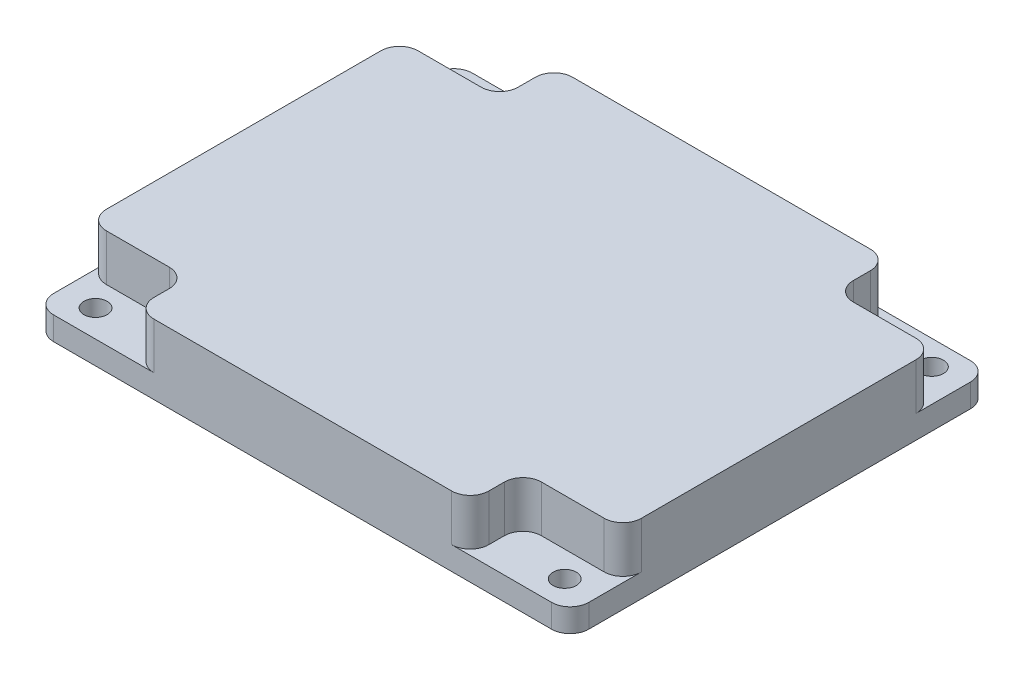
from build123d import *

# Parameters (mm, degrees)
SKETCH_1_W          = 115
SKETCH_1_H          = 90
EXTRUDE_1_DEPTH     = 15
SKETCH_2_W          = 110
SKETCH_2_H          = 85
CUT_EXTRUDE_1_DEPTH = 13
SKETCH_4_R          = 2.5
CUT_EXTRUDE_2_DEPTH = 13
CUT_EXTRUDE_3_DEPTH = 10
EXTRUDE_2_DEPTH     = 13
SKETCH_8_W          = 23.526984817
SKETCH_8_H          = 13.315340632
SKETCH_8_W_2        = 23.473015183
SKETCH_8_H_2        = 13.660063904
SKETCH_8_H_3        = 13.684659368
EXTRUDE_4_DEPTH     = 5
FILLET_1_R          = 4
FILLET_2_R          = 4
SKETCH_9_R          = 2.5
CUT_EXTRUDE_4_DEPTH = 25


with BuildPart() as part:
    # Эскиз1 → Бобышка-Вытянуть1 (new body)
    with BuildSketch(Plane(origin=(0, 0, 0), x_dir=(1, 0, 0), z_dir=(0, 1, 0))):
        with Locations((-0.217418325, 0.217418325)):
            Rectangle(SKETCH_1_W, SKETCH_1_H)
    extrude(amount=EXTRUDE_1_DEPTH)

    # Эскиз2 → Вырез-Вытянуть1 (cut)
    with BuildSketch(Plane.XZ):
        Rectangle(SKETCH_2_W, SKETCH_2_H)
    extrude(amount=-CUT_EXTRUDE_1_DEPTH, mode=Mode.SUBTRACT)

    # Эскиз4 → Вырез-Вытянуть2 (cut)
    with BuildSketch(Plane(origin=(0, 15, 0), x_dir=(1, 0, 0), z_dir=(0, 1, 0))):
        with Locations(Location((-50.146124261, 38.945020388, 0), (0, 0, 270))):
            Circle(SKETCH_4_R)
        with Locations(Location((50.678785721, -39.961430902, 0), (0, 0, 270))):
            Circle(SKETCH_4_R)
        with Locations(Location((-50.146124261, -39.961430902, 0), (0, 0, 270))):
            Circle(SKETCH_4_R)
        with Locations(Location((50.678785721, 38.945020388, 0), (0, 0, 270))):
            Circle(SKETCH_4_R)
    extrude(amount=-CUT_EXTRUDE_2_DEPTH, mode=Mode.SUBTRACT)

    # Эскиз5 → Вырез-Вытянуть3 (cut)
    with BuildSketch(Plane(origin=(0, 15, 0), x_dir=(1, 0, 0), z_dir=(0, 1, 0))):
        Polygon((-56.190433508, 33.532758957), (-36.190433508, 33.532758957), (-36.190433508, 43.532758957), (-36.190433508, 45.217418325), (-57.717418325, 45.217418325), (-57.717418325, 33.532758957), align=None)
        Polygon((-56.190433508, -33.467241043), (-36.190433508, -33.467241043), (-36.190433508, -43.467241043), (-36.190433508, -44.782581675), (-57.717418325, -44.782581675), (-57.717418325, -33.467241043), align=None)
        Polygon((55.809566492, -33.467241043), (35.809566492, -33.467241043), (35.809566492, -43.467241043), (35.809566492, -44.782581675), (57.282581675, -44.782581675), (57.282581675, -33.467241043), align=None)
        Polygon((55.809566492, 33.532758957), (35.809566492, 33.532758957), (35.809566492, 43.532758957), (35.809566492, 45.217418325), (57.282581675, 45.217418325), (57.282581675, 33.532758957), align=None)
    extrude(amount=-CUT_EXTRUDE_3_DEPTH, mode=Mode.SUBTRACT)

    # Эскиз6 → Бобышка-Вытянуть2 (add)
    with BuildSketch(Plane.XZ.offset(-13)):
        Polygon((-55, -33.532758957), (-36.190433508, -33.532758957), (-36.190433508, -42.5), (-34.190433508, -42.5), (-34.190433508, -31.557354421), (-34.190433508, -31.532758957), (-35.500302021, -31.532758957), (-55, -31.532758957), align=None)
        Polygon((-36.190433508, 42.5), (-34.190433508, 42.5), (-34.190433508, 31.467241043), (-55, 31.467241043), (-55, 33.467241043), (-36.190433508, 33.467241043), align=None)
        Polygon((35.809566492, 42.5), (33.809566492, 42.5), (33.809566492, 31.467241043), (55, 31.467241043), (55, 33.467241043), (35.809566492, 33.467241043), align=None)
        Polygon((35.809566492, -42.5), (33.809566492, -42.5), (33.809566492, -31.557354421), (55, -31.557354421), (55, -33.532758957), (35.809566492, -33.532758957), align=None)
    extrude(amount=EXTRUDE_2_DEPTH)

    # Эскиз8 → Бобышка-Вытянуть4 (add)
    with BuildSketch(Plane.XZ):
        with Locations((-45.953925917, 38.124911359)):
            Rectangle(SKETCH_8_W, SKETCH_8_H)
        with Locations((45.546074084, 38.124911359)):
            Rectangle(SKETCH_8_W_2, SKETCH_8_H)
        with Locations((45.546074084, -38.387386373)):
            Rectangle(SKETCH_8_W_2, SKETCH_8_H_2)
        with Locations((-45.953925917, -38.375088641)):
            Rectangle(SKETCH_8_W, SKETCH_8_H_3)
    extrude(amount=-EXTRUDE_4_DEPTH)

    # Скругление1
    fillet_1_edges = [part.edges().sort_by_distance(p)[0] for p in [
        (-57.717418325, 10, 33.467241043),
        (-36.190433508, 10, 44.782581675),
        (-36.190433508, 10, -45.217418325),
        (-57.717418325, 10, -33.532758957),
        (-36.190433508, 10, 33.467241043),
        (35.809566492, 10, 33.467241043),
        (35.809566492, 10, -33.532758957),
        (-36.190433508, 10, -33.532758957),
        (57.282581675, 2.5, 44.782581675),
        (-57.717418325, 2.5, 44.782581675),
        (-57.717418325, 2.5, -45.217418325),
        (57.282581675, 2.5, -45.217418325),
        (57.282581675, 10, -33.532758957),
        (35.809566492, 10, -45.217418325),
        (35.809566492, 10, 44.782581675),
        (57.282581675, 10, 33.467241043),
    ]]
    fillet(fillet_1_edges, radius=FILLET_1_R)

    # Скругление2
    fillet_2_edges = [part.edges().sort_by_distance(p)[0] for p in [
        (-55, 6.5, -31.532758957),
        (-34.190433508, 6.5, -42.5),
        (-34.190433508, 6.5, -31.532758957),
        (-55, 6.5, 31.467241043),
        (-34.190433508, 6.5, 31.467241043),
        (-34.190433508, 6.5, 42.5),
        (33.809566492, 6.5, 42.5),
        (33.809566492, 6.5, 31.467241043),
        (55, 6.5, 31.467241043),
        (55, 6.5, -31.557354421),
        (33.809566492, 6.5, -31.557354421),
        (33.809566492, 6.5, -42.5),
    ]]
    fillet(fillet_2_edges, radius=FILLET_2_R)

    # Эскиз9 → Вырез-Вытянуть4 (cut)
    with BuildSketch(Plane(origin=(0, 15, 0), x_dir=(1, 0, 0), z_dir=(0, 1, 0))):
        with Locations(Location((-50.508936052, 39.912518498, 0), (0, 0, 270))):
            Circle(SKETCH_9_R)
        with Locations(Location((50.315973929, -38.993932792, 0), (0, 0, 270))):
            Circle(SKETCH_9_R)
        with Locations(Location((-50.508936052, -38.993932792, 0), (0, 0, 270))):
            Circle(SKETCH_9_R)
        with Locations(Location((50.315973929, 39.912518498, 0), (0, 0, 270))):
            Circle(SKETCH_9_R)
    extrude(amount=-CUT_EXTRUDE_4_DEPTH, mode=Mode.SUBTRACT)


solid = part.part
